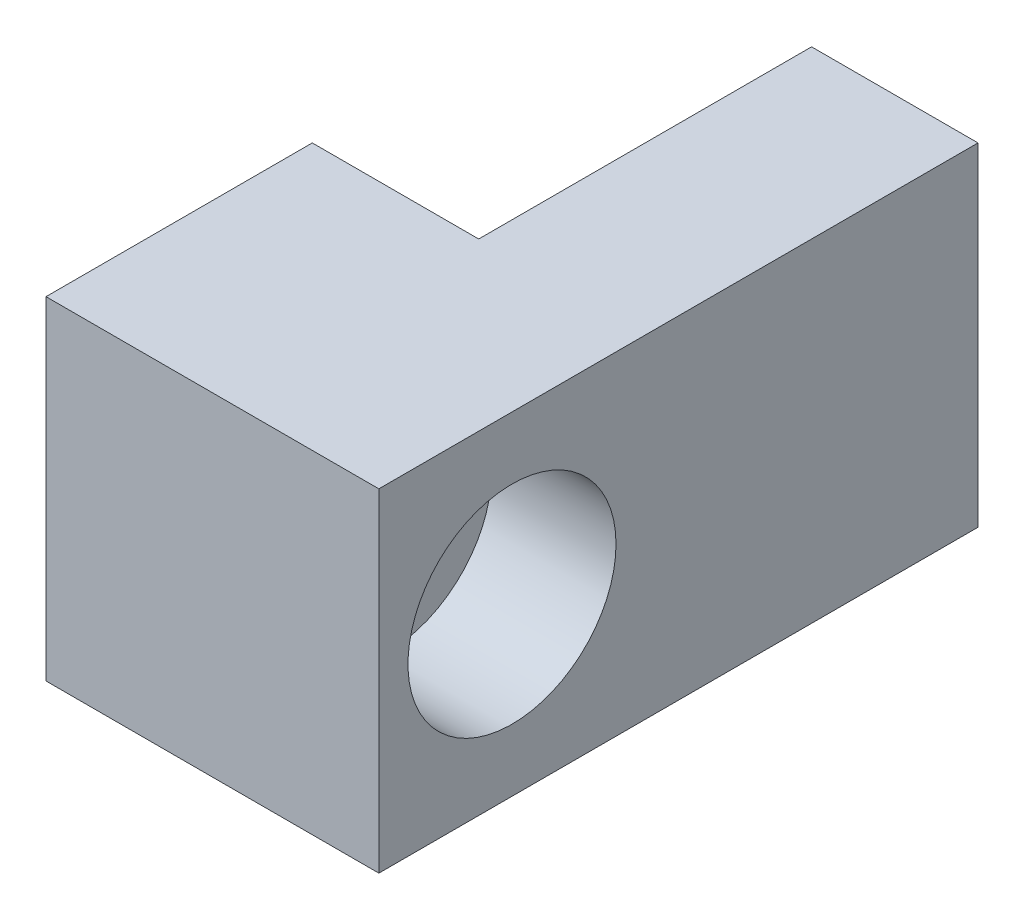
from build123d import *

# Parameters (mm, degrees)
BOSS_EXTRUDE1_DEPTH                                 = 6.35
SKETCH2_W                                           = 12.7
SKETCH2_H                                           = 12.7
BOSS_EXTRUDE2_DEPTH                                 = 10.16
CBORE_FOR_6_BINDING_HEAD_MACHINE_SCREW1_D           = 3.7973
CBORE_FOR_6_BINDING_HEAD_MACHINE_SCREW1_CBORE_D     = 7.9375
CBORE_FOR_6_BINDING_HEAD_MACHINE_SCREW1_CBORE_DEPTH = 4.7498


with BuildPart() as part:
    # Sketch1 → Boss-Extrude1 (new, symmetric)
    with BuildSketch(Plane.XY):
        with BuildLine():
            Line((-3.175, 4.7625), (-3.175, 6.35))
            Line((-3.175, 6.35), (3.175, 6.35))
            Line((3.175, 6.35), (3.175, -6.35))
            Line((3.175, -6.35), (-3.175, -6.35))
            Line((-3.175, -6.35), (-3.175, -4.7625))
            ThreePointArc((-3.175, -4.7625), (1.5875, 0), (-3.175, 4.7625))
        make_face()
    extrude(amount=BOSS_EXTRUDE1_DEPTH, both=True)

    # Sketch2 → Boss-Extrude2 (add)
    with BuildSketch(Plane.XY.offset(6.35)):
        with Locations((-3.175, 0)):
            Rectangle(SKETCH2_W, SKETCH2_H)
    extrude(amount=BOSS_EXTRUDE2_DEPTH)

    # CBORE for #6 Binding Head Machine Screw1 (through all)
    with Locations(Plane(origin=(3.175, 0, 0), x_dir=(0, 0, -1), z_dir=(1, 0, 0))):
        with Locations((-11.43, 0)):
            CounterBoreHole(CBORE_FOR_6_BINDING_HEAD_MACHINE_SCREW1_D / 2, CBORE_FOR_6_BINDING_HEAD_MACHINE_SCREW1_CBORE_D / 2, CBORE_FOR_6_BINDING_HEAD_MACHINE_SCREW1_CBORE_DEPTH)


solid = part.part
